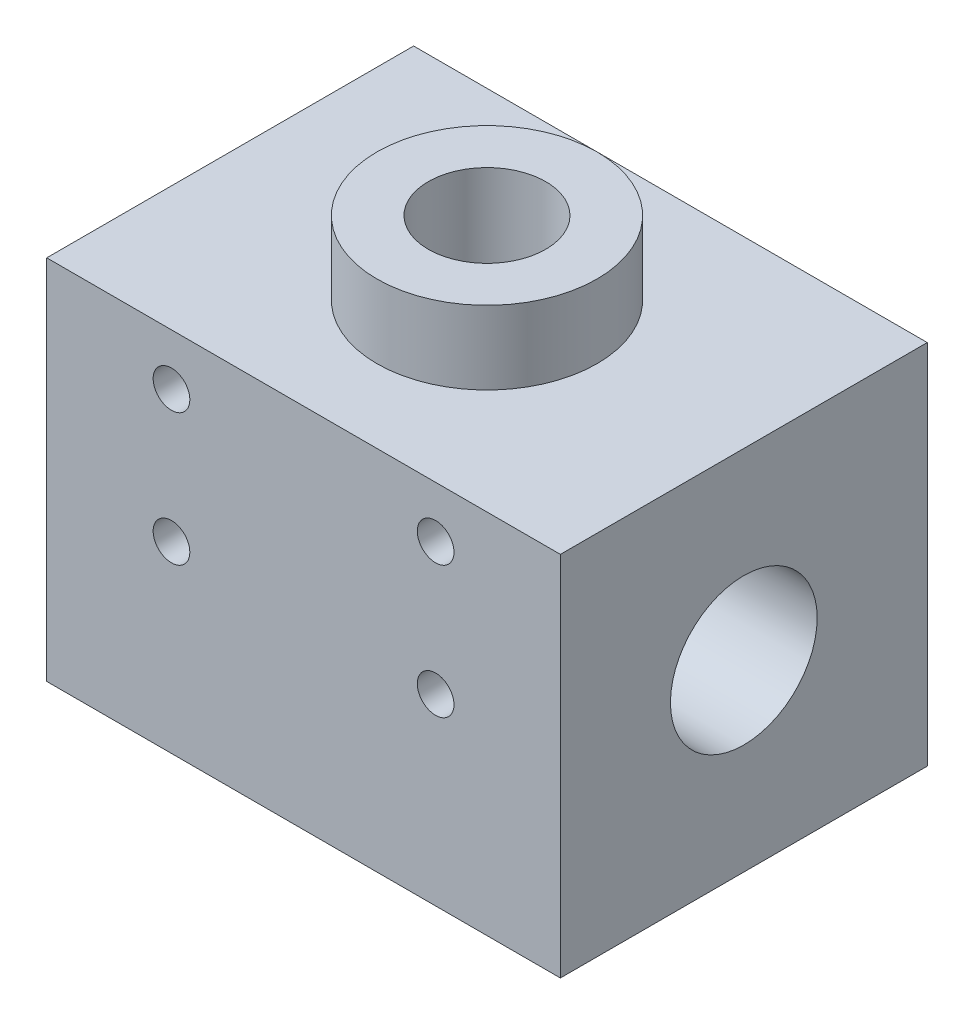
from build123d import *

# Parameters (mm, degrees)
SKETCH_1_W          = 70
SKETCH_1_H          = 50
EXTRUDE_1_DEPTH     = 50
SKETCH_2_R          = 15
EXTRUDE_2_DEPTH     = 10
SKETCH_3_R          = 10
CUT_EXTRUDE_1_DEPTH = 71
SKETCH_4_R          = 8
CUT_EXTRUDE_2_DEPTH = 35
SKETCH_5_R          = 2.5
CUT_EXTRUDE_3_DEPTH = 10


with BuildPart() as part:
    # 草图1 → 凸台-拉伸1 (new body)
    with BuildSketch(Plane(origin=(0, 0, 0), x_dir=(1, 0, 0), z_dir=(0, 1, 0))):
        Rectangle(SKETCH_1_W, SKETCH_1_H)
    extrude(amount=EXTRUDE_1_DEPTH)

    # 草图2 → 凸台-拉伸2 (add)
    with BuildSketch(Plane(origin=(0, 50, 0), x_dir=(1, 0, 0), z_dir=(0, 1, 0))):
        with Locations(Location((0, 0, 0), (0, 0, 270))):
            Circle(SKETCH_2_R)
    extrude(amount=EXTRUDE_2_DEPTH)

    # 草图3 → 切除-拉伸1 (cut, symmetric)
    with BuildSketch(Plane(origin=(0, 0, 0), x_dir=(0, 0, -1), z_dir=(1, 0, 0))):
        with Locations((0, 25)):
            Circle(SKETCH_3_R)
    extrude(amount=CUT_EXTRUDE_1_DEPTH, both=True, mode=Mode.SUBTRACT)

    # 草图4 → 切除-拉伸2 (cut)
    with BuildSketch(Plane(origin=(0, 60, 0), x_dir=(1, 0, 0), z_dir=(0, 1, 0))):
        with Locations(Location((0, 0, 0), (0, 0, 270))):
            Circle(SKETCH_4_R)
    extrude(amount=-CUT_EXTRUDE_2_DEPTH, mode=Mode.SUBTRACT)

    # 草图5 → 切除-拉伸3 (cut)
    with BuildSketch(Plane.XY.offset(25)):
        with Locations((-18, 25)):
            Circle(SKETCH_5_R)
        with Locations((18, 25)):
            Circle(SKETCH_5_R)
        with Locations((-18, 43)):
            Circle(SKETCH_5_R)
        with Locations((18, 43)):
            Circle(SKETCH_5_R)
    extrude(amount=-CUT_EXTRUDE_3_DEPTH, mode=Mode.SUBTRACT)


solid = part.part
